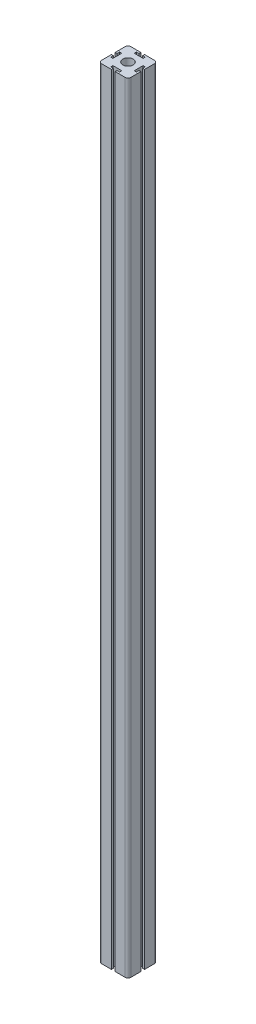
from build123d import *

# Parameters (mm, degrees)
SKETCH2_R         = 7
EXTRUDE1_DEPTH    = 1059
EXTRUDE2_DEPTH    = 1060.377647489
CIRPATTERN1_COUNT = 4


with BuildPart() as part:
    # Sketch2 → Extrude1 (new body)
    with BuildSketch(Plane(origin=(0, 0, 0), x_dir=(1, 0, 0), z_dir=(0, 1, 0))):
        with BuildLine():
            Line((-16, -20), (16, -20))
            ThreePointArc((16, -20), (18.828427125, -18.828427125), (20, -16))
            Line((20, -16), (20, 16))
            ThreePointArc((20, 16), (18.828427125, 18.828427125), (16, 20))
            Line((16, 20), (-16, 20))
            ThreePointArc((-16, 20), (-18.828427125, 18.828427125), (-20, 16))
            Line((-20, 16), (-20, -16))
            ThreePointArc((-20, -16), (-18.828427125, -18.828427125), (-16, -20))
        make_face()
        Circle(SKETCH2_R, mode=Mode.SUBTRACT)
    extrude(amount=-EXTRUDE1_DEPTH)

    # Sketch3 → Extrude2 (cut, through all)
    with BuildSketch(Plane(origin=(0, 0, 0), x_dir=(1, 0, 0), z_dir=(0, 1, 0))):
        Polygon((-2.5, 20), (-2.5, 17.5), (-6, 17.5), (-6, 14.5), (6, 14.5), (6, 17.5), (2.5, 17.5), (2.5, 20), align=None)
    extrude2 = extrude(amount=-EXTRUDE2_DEPTH, mode=Mode.SUBTRACT)

    # CirPattern1: Extrude2 ×4 about axis
    cirpattern1_axis = Axis((0, 3.5, 0), (0, -1, 0))
    for i in range(1, CIRPATTERN1_COUNT):
        add(extrude2.rotate(cirpattern1_axis, i * 360 / CIRPATTERN1_COUNT), mode=Mode.SUBTRACT)


solid = part.part
